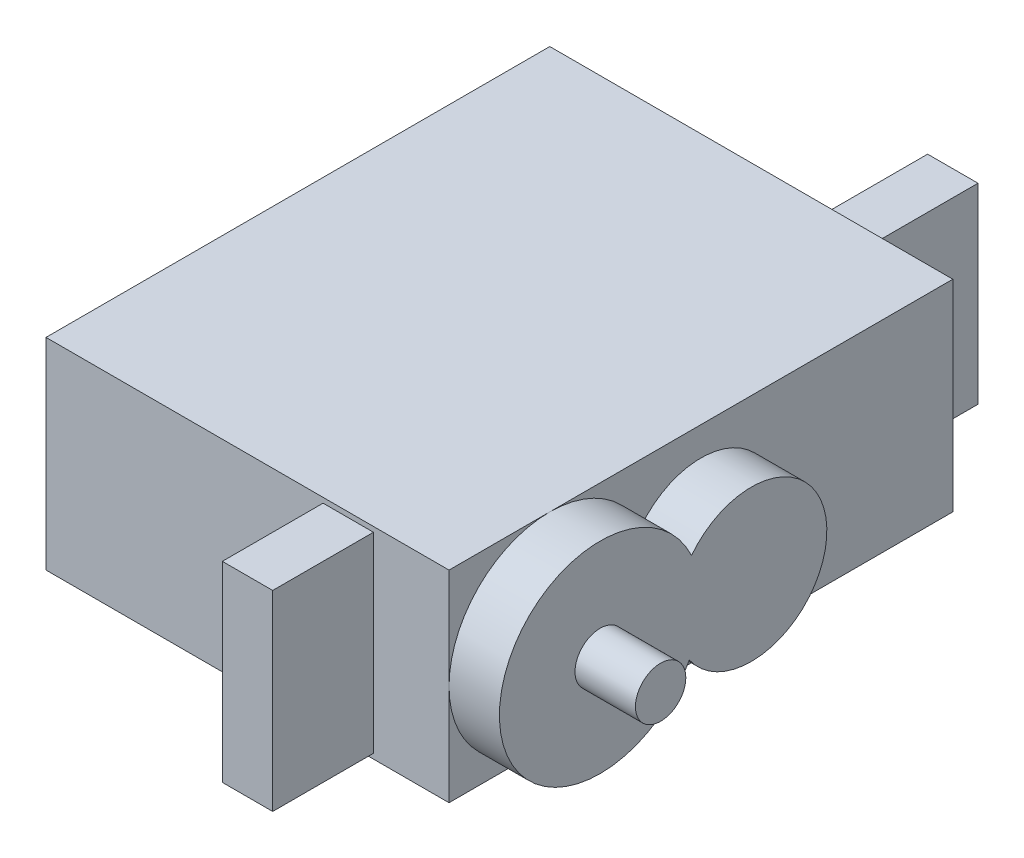
from build123d import *

# Parameters (mm, degrees)
SKETCH1_W           = 20
SKETCH1_H           = 25
BOSS_EXTRUDE1_DEPTH = 10
SKETCH3_W           = 2.5
SKETCH3_H           = 9.5
BOSS_EXTRUDE3_DEPTH = 5
SKETCH4_W           = 2.5
SKETCH4_H           = 9.5
BOSS_EXTRUDE4_DEPTH = 5
BOSS_EXTRUDE5_DEPTH = 2.5
SKETCH6_R           = 1.25
BOSS_EXTRUDE6_DEPTH = 3


with BuildPart() as part:
    # Sketch1 → Boss-Extrude1 (new body)
    with BuildSketch(Plane(origin=(0, 0, 0), x_dir=(1, 0, 0), z_dir=(0, 1, 0))):
        Rectangle(SKETCH1_W, SKETCH1_H)
    extrude(amount=BOSS_EXTRUDE1_DEPTH)

    # Sketch3 → Boss-Extrude3 (add)
    with BuildSketch(Plane(origin=(0, 0, -12.5), x_dir=(-1, 0, 0), z_dir=(0, 0, -1))):
        with Locations((-5, 5)):
            Rectangle(SKETCH3_W, SKETCH3_H)
    extrude(amount=BOSS_EXTRUDE3_DEPTH)

    # Sketch4 → Boss-Extrude4 (add)
    with BuildSketch(Plane.XY.offset(12.5)):
        with Locations((5, 5)):
            Rectangle(SKETCH4_W, SKETCH4_H)
    extrude(amount=BOSS_EXTRUDE4_DEPTH)

    # Sketch5 → Boss-Extrude5 (add)
    with BuildSketch(Plane(origin=(10, 0, 0), x_dir=(0, 0, -1), z_dir=(1, 0, 0))):
        with BuildLine():
            ThreePointArc((-2.967408029, 7.110831595), (-12.498528779, 5.121284968), (-3.075116724, 2.671823033))
            ThreePointArc((-3.075116724, 2.671823033), (3.748896584, 4.727055275), (-2.967408029, 7.110831595))
        make_face()
    extrude(amount=BOSS_EXTRUDE5_DEPTH)

    # Sketch6 → Boss-Extrude6 (add)
    with BuildSketch(Plane(origin=(12.5, 0, 0), x_dir=(0, 0, -1), z_dir=(1, 0, 0))):
        with Locations((-7.5, 5)):
            Circle(SKETCH6_R)
    extrude(amount=BOSS_EXTRUDE6_DEPTH)


solid = part.part
